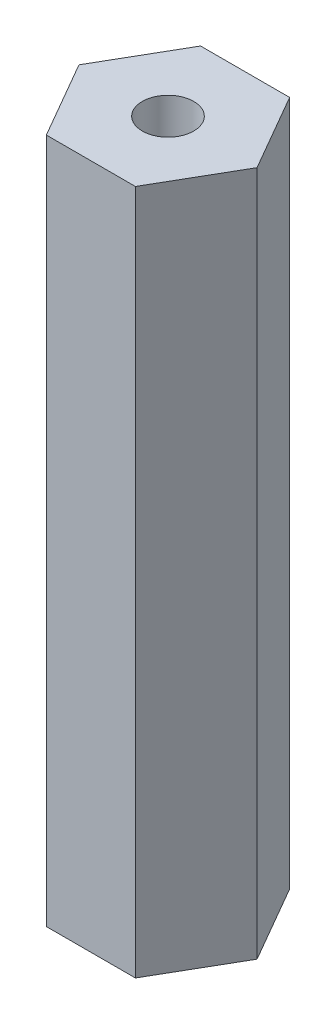
from build123d import *

# Parameters (mm, degrees)
CROQUIS1_R              = 1.5
SALIENTE_EXTRUIR1_DEPTH = 20


with BuildPart() as part:
    # Croquis1 → Saliente-Extruir1 (new, symmetric)
    with BuildSketch(Plane(origin=(0, 0, 0), x_dir=(1, 0, 0), z_dir=(0, 1, 0))):
        Polygon((-2.598076211, -4.5), (2.598076211, -4.5), (5.196152423, 0), (2.598076211, 4.5), (-2.598076211, 4.5), (-5.196152423, 0), align=None)
        with Locations(Location((0, 0, 0), (0, 0, 270))):
            Circle(CROQUIS1_R, mode=Mode.SUBTRACT)
    extrude(amount=SALIENTE_EXTRUIR1_DEPTH, both=True)


solid = part.part
